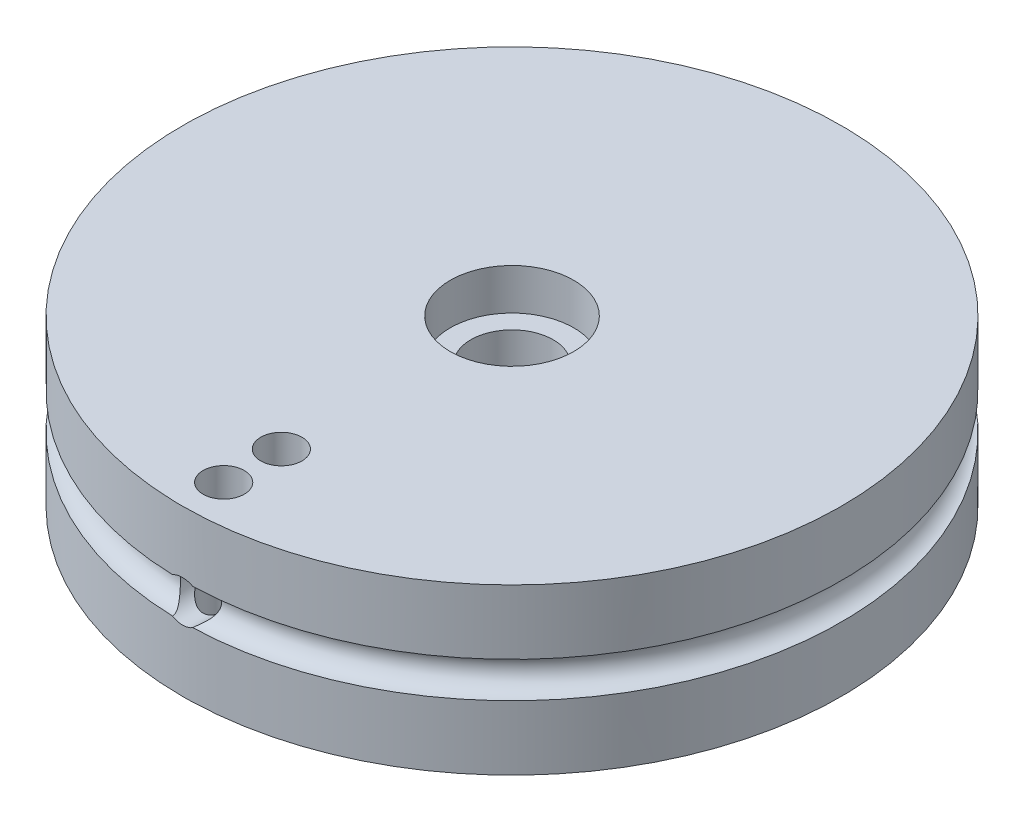
from build123d import *

# Parameters (mm, degrees)
SKETCH1_R           = 10.16
SKETCH1_R_2         = 2.38125
BOSS_EXTRUDE1_DEPTH = 5.08
BOSS_EXTRUDE2_START = -2.54
SKETCH2_R           = 2.38125
SKETCH2_R_2         = 1.27
BOSS_EXTRUDE2_DEPTH = 2.54
SKETCH3_R           = 1.905
CUT_EXTRUDE1_DEPTH  = 1.27
SKETCH4_R           = 0.552075519
SKETCH5_R           = 0.635
CUT_EXTRUDE2_DEPTH  = 16.24
SKETCH6_R           = 0.635
CUT_EXTRUDE3_DEPTH  = 3.683


with BuildPart() as part:
    # Sketch1 → Boss-Extrude1 (new body)
    with BuildSketch(Plane(origin=(0, 0, 0), x_dir=(1, 0, 0), z_dir=(0, 1, 0))):
        with Locations(Location((0, 0, 0), (0, 0, 270))):
            Circle(SKETCH1_R)
        with Locations(Location((0, 0, 0), (0, 0, 270))):
            Circle(SKETCH1_R_2, mode=Mode.SUBTRACT)
    extrude(amount=BOSS_EXTRUDE1_DEPTH)

    # Sketch2 → Boss-Extrude2 (add)
    with BuildSketch(Plane(origin=(0, 5.08, 0), x_dir=(1, 0, 0), z_dir=(0, 1, 0)).offset(BOSS_EXTRUDE2_START)):
        with Locations(Location((0, 0, 0), (0, 0, 270))):
            Circle(SKETCH2_R)
        with Locations(Location((0, 0, 0), (0, 0, 270))):
            Circle(SKETCH2_R_2, mode=Mode.SUBTRACT)
    extrude(amount=BOSS_EXTRUDE2_DEPTH)

    # Sketch3 → Cut-Extrude1 (cut)
    with BuildSketch(Plane(origin=(0, 5.08, 0), x_dir=(1, 0, 0), z_dir=(0, 1, 0))):
        with Locations(Location((0, 0, 0), (0, 0, 270))):
            Circle(SKETCH3_R)
    extrude(amount=-CUT_EXTRUDE1_DEPTH, mode=Mode.SUBTRACT)

    # Sketch4 → Cut-Revolve1 (revolve, cut)
    with BuildSketch(Plane.XY, mode=Mode.PRIVATE) as cut_revolve1_sk:
        with Locations((10.16, 2.54)):
            Circle(SKETCH4_R)
    revolve(cut_revolve1_sk.sketch.rotate(Axis((0, 6.474479785, 0), (0, -1, 0)), 90), axis=Axis((0, 6.474479785, 0), (0, -1, 0)), mode=Mode.SUBTRACT)

    # Sketch5 → Cut-Extrude2 (cut, through all)
    with BuildSketch(Plane(origin=(0, 5.08, 0), x_dir=(1, 0, 0), z_dir=(0, 1, 0))):
        with Locations(Location((0, -8.89, 0), (0, 0, 270))):
            Circle(SKETCH5_R)
        with Locations(Location((0, -7.112, 0), (0, 0, 270))):
            Circle(SKETCH5_R)
    extrude(amount=-CUT_EXTRUDE2_DEPTH, mode=Mode.SUBTRACT)

    # Sketch6 → Cut-Extrude3 (cut)
    with BuildSketch(Plane.XY.offset(10.16)):
        with Locations((0, 2.54)):
            Circle(SKETCH6_R)
    extrude(amount=-CUT_EXTRUDE3_DEPTH, mode=Mode.SUBTRACT)


solid = part.part
